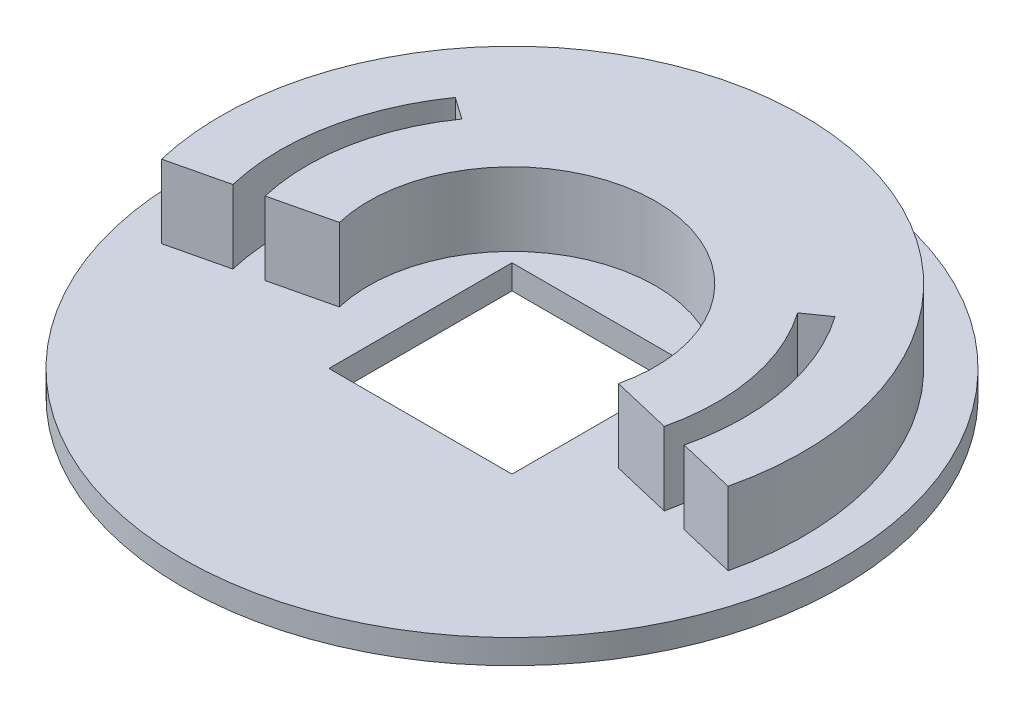
from build123d import *

# Parameters (mm, degrees)
BOSS_EXTRUDE1_DEPTH = 6
SKETCH2_R           = 27
SKETCH2_W           = 15
SKETCH2_H           = 15
BOSS_EXTRUDE2_DEPTH = 2
CUT_EXTRUDE1_DEPTH  = 6


with BuildPart() as part:
    # Sketch1 → Boss-Extrude1 (new body)
    with BuildSketch(Plane(origin=(0, 0, 0), x_dir=(1, 0, 0), z_dir=(0, 1, 0))):
        with BuildLine():
            Line((-23.207164842, -5.5), (-11.433299241, -2.709643606))
            ThreePointArc((-11.433299241, -2.709643606), (0, 11.75), (11.433299241, -2.709643606))
            Line((11.433299241, -2.709643606), (23.207164842, -5.5))
            ThreePointArc((23.207164842, -5.5), (0, 23.85), (-23.207164842, -5.5))
        make_face()
    extrude(amount=BOSS_EXTRUDE1_DEPTH)

    # Sketch2 → Boss-Extrude2 (add)
    with BuildSketch(Plane.XZ):
        with Locations(Location((0, 0, 0), (0, 0, 270))):
            Circle(SKETCH2_R)
        Rectangle(SKETCH2_W, SKETCH2_H, mode=Mode.SUBTRACT)
    extrude(amount=BOSS_EXTRUDE2_DEPTH)

    # Sketch3 → Cut-Extrude1 (cut)
    with BuildSketch(Plane(origin=(0, 6, 0), x_dir=(1, 0, 0), z_dir=(0, 1, 0))):
        with BuildLine():
            Line((-15.555508902, 10.909910303), (-13.754344713, 9.646657531))
            ThreePointArc((-13.754344713, 9.646657531), (-16.499364166, 3.16401361), (-16.347185297, -3.874213836))
            Line((-16.347185297, -3.874213836), (-18.487888134, -4.381551363))
            ThreePointArc((-18.487888134, -4.381551363), (-18.659995187, 3.578348726), (-15.555508902, 10.909910303))
        make_face()
    cut_extrude1 = extrude(amount=-CUT_EXTRUDE1_DEPTH, mode=Mode.SUBTRACT)

    # Mirror1: Cut-Extrude1 across plane
    add(cut_extrude1.mirror(Plane(origin=(0, 0, 0), x_dir=(0, 0, 1), z_dir=(1, 0, 0))), mode=Mode.SUBTRACT)


solid = part.part
